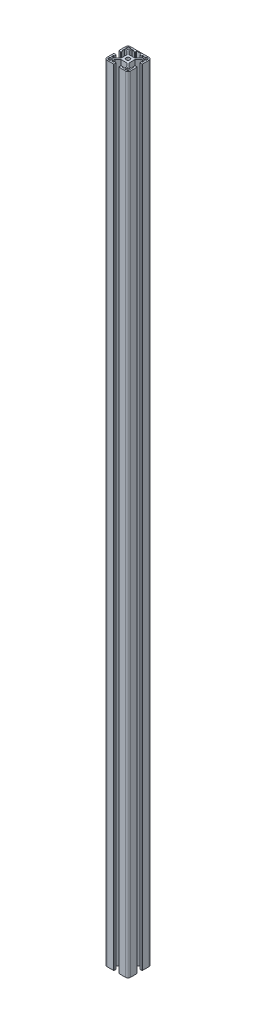
from build123d import *

# Parameters (mm, degrees)
SKETCH2_R           = 2.5
BOSS_EXTRUDE1_DEPTH = 1000


with BuildPart() as part:
    # Sketch2 → Boss-Extrude1 (new body)
    with BuildSketch(Plane(origin=(0, 0, 0), x_dir=(1, 0, 0), z_dir=(0, 1, 0))):
        with BuildLine():
            Line((3.6, -15), (12, -15))
            ThreePointArc((12, -15), (14.121320344, -14.121320344), (15, -12))
            Line((15, -12), (15, -3.6))
            ThreePointArc((15, -3.6), (14.853553391, -3.246446609), (14.5, -3.1))
            Line((14.5, -3.1), (12.5, -3.1))
            ThreePointArc((12.5, -3.1), (12.146446609, -3.246446609), (12, -3.6))
            Line((12, -3.6), (12, -5.6))
            Line((12, -5.6), (12.5, -5.6))
            ThreePointArc((12.5, -5.6), (12.853553391, -5.746446609), (13, -6.1))
            Line((13, -6.1), (13, -8.25))
            Line((13, -8.25), (10.492640687, -8.25))
            ThreePointArc((10.492640687, -8.25), (9.727273822, -8.097759065), (9.078427125, -7.664213562))
            Line((9.078427125, -7.664213562), (5.25, -3.835786438))
            Line((5.25, -3.835786438), (5.25, 3.835786438))
            Line((5.25, 3.835786438), (9.078427125, 7.664213562))
            ThreePointArc((9.078427125, 7.664213562), (9.727273822, 8.097759065), (10.492640687, 8.25))
            Line((10.492640687, 8.25), (13, 8.25))
            Line((13, 8.25), (13, 6.1))
            ThreePointArc((13, 6.1), (12.853553391, 5.746446609), (12.5, 5.6))
            Line((12.5, 5.6), (12, 5.6))
            Line((12, 5.6), (12, 3.6))
            ThreePointArc((12, 3.6), (12.146446609, 3.246446609), (12.5, 3.1))
            Line((12.5, 3.1), (14.5, 3.1))
            ThreePointArc((14.5, 3.1), (14.853553391, 3.246446609), (15, 3.6))
            Line((15, 3.6), (15, 12))
            ThreePointArc((15, 12), (14.121320344, 14.121320344), (12, 15))
            Line((12, 15), (-12, 15))
            ThreePointArc((-12, 15), (-14.121320344, 14.121320344), (-15, 12))
            Line((-15, 12), (-15, 3.6))
            ThreePointArc((-15, 3.6), (-14.853553391, 3.246446609), (-14.5, 3.1))
            Line((-14.5, 3.1), (-12.5, 3.1))
            ThreePointArc((-12.5, 3.1), (-12.146446609, 3.246446609), (-12, 3.6))
            Line((-12, 3.6), (-12, 5.6))
            Line((-12, 5.6), (-12.5, 5.6))
            ThreePointArc((-12.5, 5.6), (-12.853553391, 5.746446609), (-13, 6.1))
            Line((-13, 6.1), (-13, 8.25))
            Line((-13, 8.25), (-10.492640687, 8.25))
            ThreePointArc((-10.492640687, 8.25), (-9.727273822, 8.097759065), (-9.078427125, 7.664213562))
            Line((-9.078427125, 7.664213562), (-5.25, 3.835786438))
            Line((-5.25, 3.835786438), (-5.25, -3.835786438))
            Line((-5.25, -3.835786438), (-9.078427125, -7.664213562))
            ThreePointArc((-9.078427125, -7.664213562), (-9.727273822, -8.097759065), (-10.492640687, -8.25))
            Line((-10.492640687, -8.25), (-13, -8.25))
            Line((-13, -8.25), (-13, -6.1))
            ThreePointArc((-13, -6.1), (-12.853553391, -5.746446609), (-12.5, -5.6))
            Line((-12.5, -5.6), (-12, -5.6))
            Line((-12, -5.6), (-12, -3.6))
            ThreePointArc((-12, -3.6), (-12.146446609, -3.246446609), (-12.5, -3.1))
            Line((-12.5, -3.1), (-14.5, -3.1))
            ThreePointArc((-14.5, -3.1), (-14.853553391, -3.246446609), (-15, -3.6))
            Line((-15, -3.6), (-15, -12))
            ThreePointArc((-15, -12), (-14.121320344, -14.121320344), (-12, -15))
            Line((-12, -15), (-3.6, -15))
            ThreePointArc((-3.6, -15), (-3.246446609, -14.853553391), (-3.1, -14.5))
            Line((-3.1, -14.5), (-3.1, -12.5))
            ThreePointArc((-3.1, -12.5), (-3.246446609, -12.146446609), (-3.6, -12))
            Line((-3.6, -12), (-5.6, -12))
            Line((-5.6, -12), (-5.6, -12.5))
            ThreePointArc((-5.6, -12.5), (-5.746446609, -12.853553391), (-6.1, -13))
            Line((-6.1, -13), (-8, -13))
            Line((-8, -13), (-8, -10.242640687))
            ThreePointArc((-8, -10.242640687), (-7.847759065, -9.477273822), (-7.414213562, -8.828427125))
            Line((-7.414213562, -8.828427125), (-3.835786438, -5.25))
            Line((-3.835786438, -5.25), (3.835786438, -5.25))
            Line((3.835786438, -5.25), (7.414213562, -8.828427125))
            ThreePointArc((7.414213562, -8.828427125), (7.847759065, -9.477273822), (8, -10.242640687))
            Line((8, -10.242640687), (8, -13))
            Line((8, -13), (6.1, -13))
            ThreePointArc((6.1, -13), (5.746446609, -12.853553391), (5.6, -12.5))
            Line((5.6, -12.5), (5.6, -12))
            Line((5.6, -12), (3.6, -12))
            ThreePointArc((3.6, -12), (3.246446609, -12.146446609), (3.1, -12.5))
            Line((3.1, -12.5), (3.1, -14.5))
            ThreePointArc((3.1, -14.5), (3.246446609, -14.853553391), (3.6, -15))
        make_face()
        with Locations(Location((0, 0, 0), (0, 0, 270))):
            Circle(SKETCH2_R, mode=Mode.SUBTRACT)
        with BuildLine():
            Line((-3.835786438, 5.25), (3.835786438, 5.25))
            Line((3.835786438, 5.25), (7.414213562, 8.828427125))
            ThreePointArc((7.414213562, 8.828427125), (7.847759065, 9.477273822), (8, 10.242640687))
            Line((8, 10.242640687), (8, 13))
            Line((8, 13), (6.1, 13))
            ThreePointArc((6.1, 13), (5.746446609, 12.853553391), (5.6, 12.5))
            Line((5.6, 12.5), (5.6, 12))
            Line((5.6, 12), (3.6, 12))
            ThreePointArc((3.6, 12), (3.246446609, 12.146446609), (3.1, 12.5))
            Line((3.1, 12.5), (3.1, 14))
            Line((3.1, 14), (-3.1, 14))
            Line((-3.1, 14), (-3.1, 12.5))
            ThreePointArc((-3.1, 12.5), (-3.246446609, 12.146446609), (-3.6, 12))
            Line((-3.6, 12), (-5.6, 12))
            Line((-5.6, 12), (-5.6, 12.5))
            ThreePointArc((-5.6, 12.5), (-5.746446609, 12.853553391), (-6.1, 13))
            Line((-6.1, 13), (-8, 13))
            Line((-8, 13), (-8, 10.242640687))
            ThreePointArc((-8, 10.242640687), (-7.847759065, 9.477273822), (-7.414213562, 8.828427125))
            Line((-7.414213562, 8.828427125), (-3.835786438, 5.25))
        make_face(mode=Mode.SUBTRACT)
        with BuildLine():
            Line((9.5, -9.75), (13.25, -9.75))
            Line((13.25, -9.75), (13.25, -11.5))
            ThreePointArc((13.25, -11.5), (12.664213562, -12.914213562), (11.25, -13.5))
            Line((11.25, -13.5), (9.5, -13.5))
            Line((9.5, -13.5), (9.5, -9.75))
        make_face(mode=Mode.SUBTRACT)
        with BuildLine():
            Line((-13.25, -9.75), (-13.25, -11.5))
            ThreePointArc((-13.25, -11.5), (-12.664213562, -12.914213562), (-11.25, -13.5))
            Line((-11.25, -13.5), (-9.5, -13.5))
            Line((-9.5, -13.5), (-9.5, -9.75))
            Line((-9.5, -9.75), (-13.25, -9.75))
        make_face(mode=Mode.SUBTRACT)
        with BuildLine():
            Line((-9.5, 9.75), (-13.25, 9.75))
            Line((-13.25, 9.75), (-13.25, 11.5))
            ThreePointArc((-13.25, 11.5), (-12.664213562, 12.914213562), (-11.25, 13.5))
            Line((-11.25, 13.5), (-9.5, 13.5))
            Line((-9.5, 13.5), (-9.5, 9.75))
        make_face(mode=Mode.SUBTRACT)
        with BuildLine():
            Line((13.25, 9.75), (13.25, 11.5))
            ThreePointArc((13.25, 11.5), (12.664213562, 12.914213562), (11.25, 13.5))
            Line((11.25, 13.5), (9.5, 13.5))
            Line((9.5, 13.5), (9.5, 9.75))
            Line((9.5, 9.75), (13.25, 9.75))
        make_face(mode=Mode.SUBTRACT)
    extrude(amount=BOSS_EXTRUDE1_DEPTH)


solid = part.part
